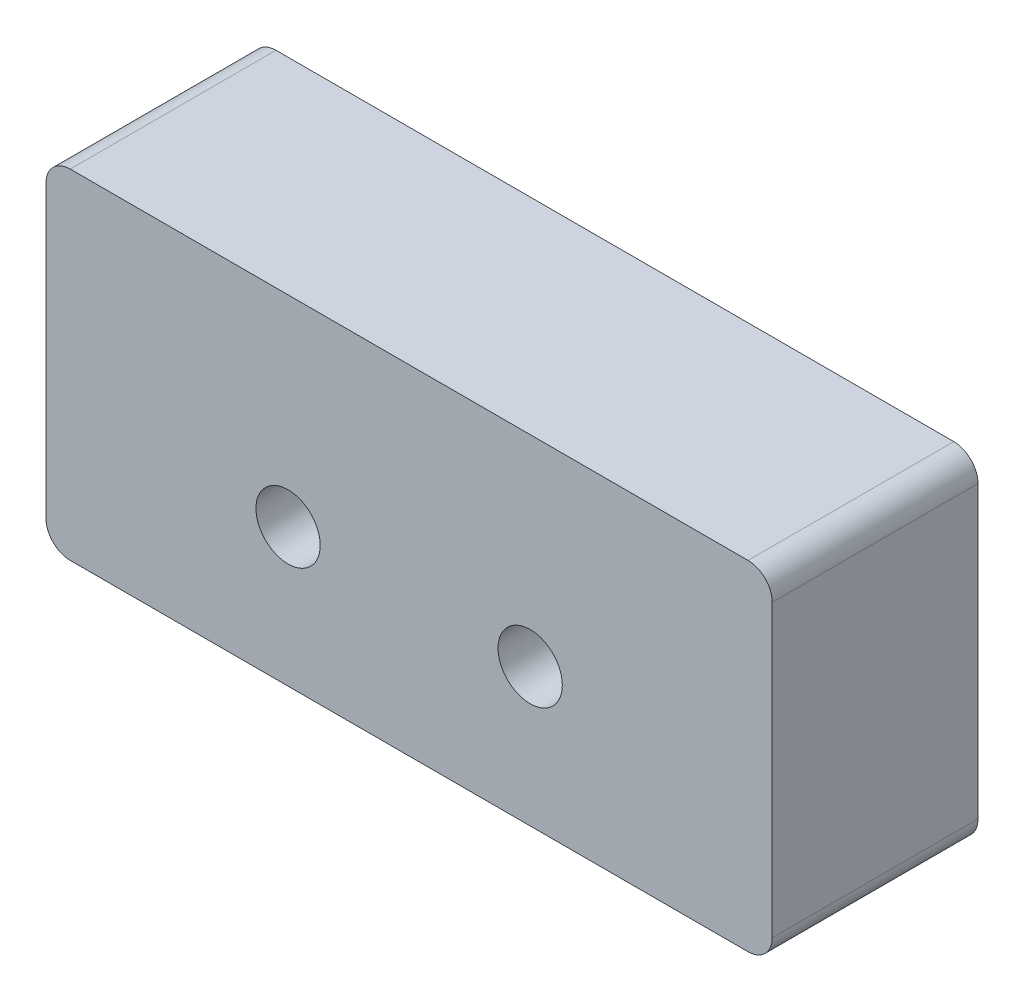
from build123d import *

# Parameters (mm, degrees)
SKETCH1_W           = 76.2
SKETCH1_H           = 35.56
SKETCH1_R           = 3.3734375
BOSS_EXTRUDE1_DEPTH = 21.59
FILLET1_R           = 2.54


with BuildPart() as part:
    # Sketch1 → Boss-Extrude1 (new body)
    with BuildSketch(Plane.XY):
        with Locations((38.1, 17.78)):
            Rectangle(SKETCH1_W, SKETCH1_H)
        with Locations((25.4, 14.478)):
            Circle(SKETCH1_R, mode=Mode.SUBTRACT)
        with Locations((50.8, 14.478)):
            Circle(SKETCH1_R, mode=Mode.SUBTRACT)
    extrude(amount=BOSS_EXTRUDE1_DEPTH)

    # Fillet1
    fillet1_edges = [part.edges().sort_by_distance(p)[0] for p in [
        (0, 0, 10.795),
        (0, 35.56, 10.795),
        (76.2, 35.56, 10.795),
        (76.2, 0, 10.795),
    ]]
    fillet(fillet1_edges, radius=FILLET1_R)


solid = part.part
